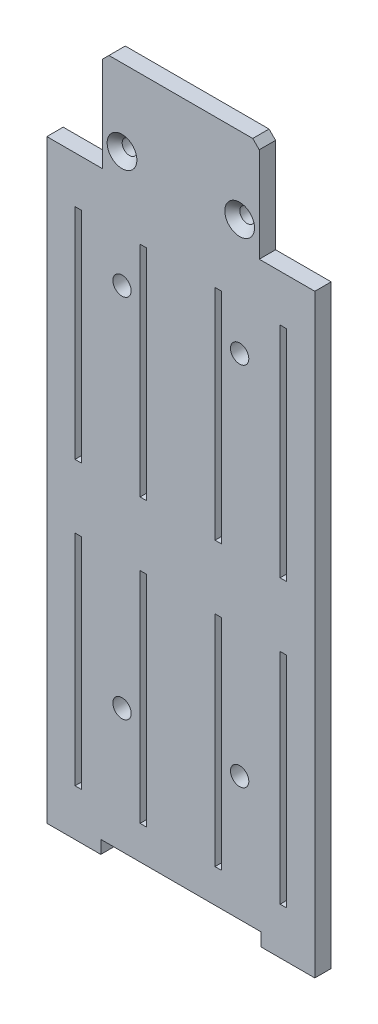
from build123d import *

# Parameters (mm, degrees)
BOSS_EXTRU_1_DEPTH              = 2.5
BOSS_EXTRU_2_DEPTH              = 30.59
ESQUISSE5_W                     = 2
ESQUISSE5_H                     = 67
ENL_V_MAT_EXTRU_1_DEPTH         = 130.359962894
ESQUISSE14_W                    = 49
ESQUISSE14_H                    = 4
ENL_V_MAT_EXTRU_5_DEPTH         = 129.953479984
R_P_TITION_LIN_AIRE2_COUNT      = 2
R_P_TITION_LIN_AIRE2_PITCH      = 19.921
ESQUISSE17_R                    = 2.25
ENL_V_MAT_EXTRU_7_DEPTH         = 10
ESQUISSE15_W                    = 55
ESQUISSE15_H                    = 7
BOSS_EXTRU_4_DEPTH              = 4
CHANFREIN3_SIZE                 = 1
CHANFREIN4_SIZE                 = 2
ESQUISSE19_R                    = 2.8
ENL_V_MAT_EXTRU_9_DEPTH         = 8
CHANFREIN5_SIZE                 = 2.3
SYM_TRIE9_COPY_1_SKETCH_W       = 2
SYM_TRIE9_COPY_1_SKETCH_H       = 67
SYM_TRIE9_COPY_1_DEPTH          = 130.359962894
ESQUISSE20_R                    = 2.8
ENL_V_MAT_EXTRU_10_DEPTH        = 10
R_P_TITION_LIN_AIRE3_COUNT      = 2
R_P_TITION_LIN_AIRE3_PITCH      = 36
R_P_TITION_LIN_AIRE3_COUNT_DIR2 = 2
R_P_TITION_LIN_AIRE3_PITCH_DIR2 = 112


with BuildPart() as part:
    # Esquisse1 → Boss.-Extru.1 (new, symmetric)
    with BuildSketch(Plane.XY):
        Polygon((-41, -91), (-15.008, -91), (41, -91), (41, 91), (24, 91), (24, 122), (-24, 122), (-24, 91), (-41, 91), align=None)
    extrude(amount=BOSS_EXTRU_1_DEPTH, both=True)

    # Esquisse6 → Boss.-Extru.2 (add, symmetric)
    with BuildSketch(Plane(origin=(0, 0, 0), x_dir=(0, 0, -1), z_dir=(1, 0, 0))):
        with BuildLine():
            Line((2.5, -57.94427191), (2.5, -40.05572809))
            ThreePointArc((2.5, -40.05572809), (10.5, -49), (2.5, -57.94427191))
        make_face()
        with BuildLine():
            Line((2.5, 54.05572809), (2.5, 71.94427191))
            ThreePointArc((2.5, 71.94427191), (10.5, 63), (2.5, 54.05572809))
        make_face()
    extrude(amount=BOSS_EXTRU_2_DEPTH, both=True)

    # Esquisse5 → Enlèv. mat.-Extru.1 (cut, symmetric)
    with BuildSketch(Plane.XY.offset(2.5)):
        with Locations((31.3815, -43.25)):
            Rectangle(ESQUISSE5_W, ESQUISSE5_H)
        with Locations((31.3815, 43.25)):
            Rectangle(ESQUISSE5_W, ESQUISSE5_H)
    enl_v_mat_extru_1 = extrude(amount=ENL_V_MAT_EXTRU_1_DEPTH, both=True, mode=Mode.SUBTRACT)

    # Esquisse14 → Enlèv. mat.-Extru.5 (cut, through all)
    with BuildSketch(Plane(origin=(0, 0, -2.5), x_dir=(-1, 0, 0), z_dir=(0, 0, -1))):
        with Locations((0, -89)):
            Rectangle(ESQUISSE14_W, ESQUISSE14_H)
    extrude(amount=-ENL_V_MAT_EXTRU_5_DEPTH, mode=Mode.SUBTRACT)

    # Répétition linéaire2: Enlèv. mat.-Extru.1 ×2
    with Locations(*[(-i * R_P_TITION_LIN_AIRE2_PITCH, 0, 0) for i in range(1, R_P_TITION_LIN_AIRE2_COUNT)]):
        add(enl_v_mat_extru_1, mode=Mode.SUBTRACT)

    # Esquisse17 → Enlèv. mat.-Extru.7 (cut)
    with BuildSketch(Plane.XY.offset(2.5)):
        with Locations((18, 98.55)):
            Circle(ESQUISSE17_R)
        with Locations((-18, 98.55)):
            Circle(ESQUISSE17_R)
    extrude(amount=-ENL_V_MAT_EXTRU_7_DEPTH, mode=Mode.SUBTRACT)

    # Esquisse15 → Boss.-Extru.4 (add)
    with BuildSketch(Plane(origin=(0, 0, -2.5), x_dir=(-1, 0, 0), z_dir=(0, 0, -1))):
        with Locations((0, -87.5)):
            Rectangle(ESQUISSE15_W, ESQUISSE15_H)
    extrude(amount=BOSS_EXTRU_4_DEPTH)

    # Chanfrein3
    chanfrein3_edges = [part.edges().sort_by_distance(p)[0] for p in [
        (27.5, -87.5, -2.5),
        (-27.5, -87.5, -2.5),
        (0, -84, -2.5),
        (27.5, -87.5, -6.5),
        (-27.5, -87.5, -6.5),
        (0, -84, -6.5),
    ]]
    chamfer(chanfrein3_edges, length=CHANFREIN3_SIZE)

    # Chanfrein4
    chanfrein4_edges = [part.edges().sort_by_distance(p)[0] for p in [
        (-24, 122, 0),
        (24, 122, 0),
    ]]
    chamfer(chanfrein4_edges, length=CHANFREIN4_SIZE)

    # Esquisse19 → Enlèv. mat.-Extru.9 (cut)
    with BuildSketch(Plane(origin=(30.3815, 0, 0), x_dir=(0, 0, -1), z_dir=(1, 0, 0))):
        with Locations(Location((6, 63, 0), (0, 0, 90))):
            Circle(ESQUISSE19_R)
        with Locations(Location((6, -49, 0), (0, 0, 90))):
            Circle(ESQUISSE19_R)
    enl_v_mat_extru_9 = extrude(amount=-ENL_V_MAT_EXTRU_9_DEPTH, mode=Mode.SUBTRACT)

    # Symétrie8: Enlèv. mat.-Extru.9 across plane
    add(enl_v_mat_extru_9.mirror(Plane(origin=(0, 0, 0), x_dir=(0, 0, 1), z_dir=(1, 0, 0))), mode=Mode.SUBTRACT)

    # Chanfrein5
    chanfrein5_edges = [part.edges().sort_by_distance(p)[0] for p in [
        (15.75, 98.55, 2.5),
        (-20.25, 98.55, 2.5),
    ]]
    chamfer(chanfrein5_edges, length=CHANFREIN5_SIZE)

    # Symétrie9: Enlèv. mat.-Extru.1 across plane
    add(enl_v_mat_extru_1.mirror(Plane(origin=(0, 0, 0), x_dir=(0, 0, 1), z_dir=(1, 0, 0))), mode=Mode.SUBTRACT)

    # Symétrie9 copy 1 sketch → Symétrie9 copy 1 (cut, symmetric)
    with BuildSketch(Plane(origin=(19.921, 0, 2.5), x_dir=(-1, 0, 0), z_dir=(0, 0, 1))):
        with Locations((31.3815, 43.25)):
            Rectangle(SYM_TRIE9_COPY_1_SKETCH_W, SYM_TRIE9_COPY_1_SKETCH_H)
        with Locations((31.3815, -43.25)):
            Rectangle(SYM_TRIE9_COPY_1_SKETCH_W, SYM_TRIE9_COPY_1_SKETCH_H)
    extrude(amount=SYM_TRIE9_COPY_1_DEPTH, both=True, mode=Mode.SUBTRACT)

    # Esquisse20 → Enlèv. mat.-Extru.10 (cut)
    with BuildSketch(Plane.XY.offset(2.5)):
        with Locations((-18, -49)):
            Circle(ESQUISSE20_R)
    enl_v_mat_extru_10 = extrude(amount=-ENL_V_MAT_EXTRU_10_DEPTH, mode=Mode.SUBTRACT)

    # Répétition linéaire3: Enl_v. mat.-Extru.10 2 × 2
    with Locations(*[(i * R_P_TITION_LIN_AIRE3_PITCH, j * R_P_TITION_LIN_AIRE3_PITCH_DIR2, 0) for i in range(R_P_TITION_LIN_AIRE3_COUNT) for j in range(R_P_TITION_LIN_AIRE3_COUNT_DIR2) if (i, j) != (0, 0)]):
        add(enl_v_mat_extru_10, mode=Mode.SUBTRACT)


solid = part.part
